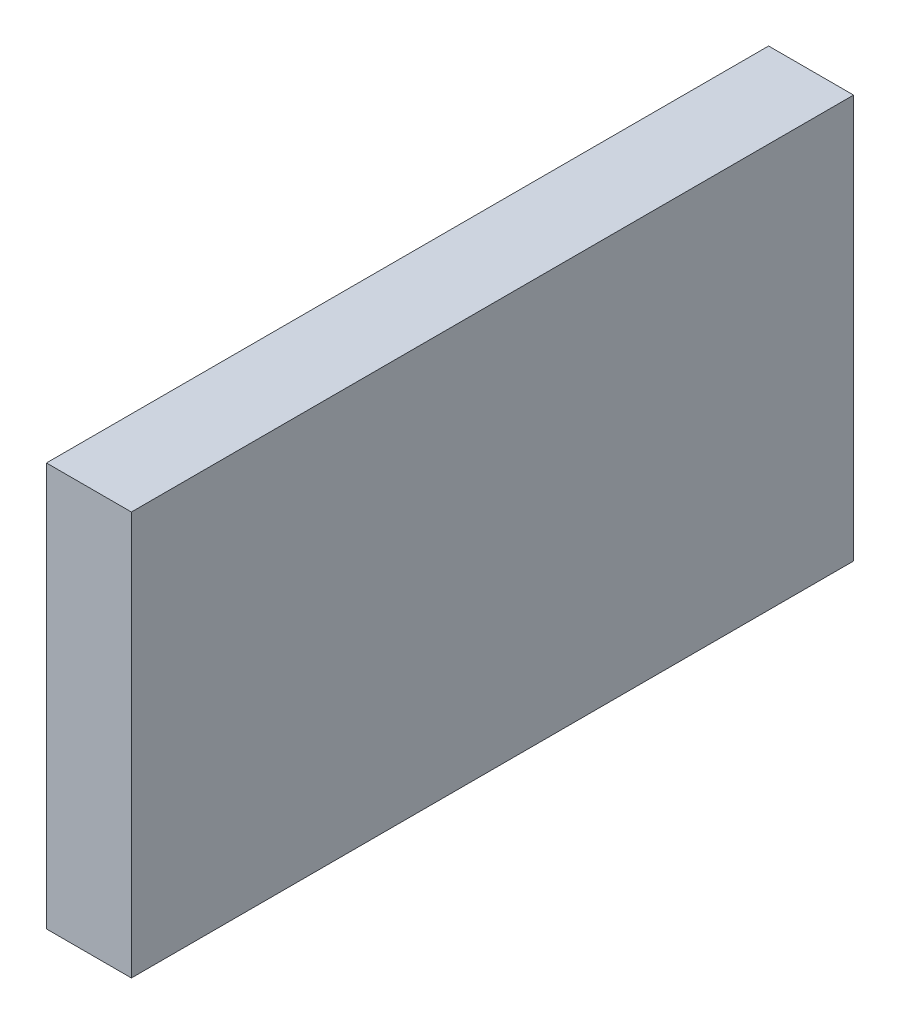
from build123d import *

# Parameters (mm, degrees)
SKETCH1_W           = 101.6
SKETCH1_H           = 482.6
BOSS_EXTRUDE1_DEPTH = 863.6


with BuildPart() as part:
    # Sketch1 → Boss-Extrude1 (new body)
    with BuildSketch(Plane.XY):
        with Locations((50.8, 241.3)):
            Rectangle(SKETCH1_W, SKETCH1_H)
    extrude(amount=BOSS_EXTRUDE1_DEPTH)


solid = part.part
